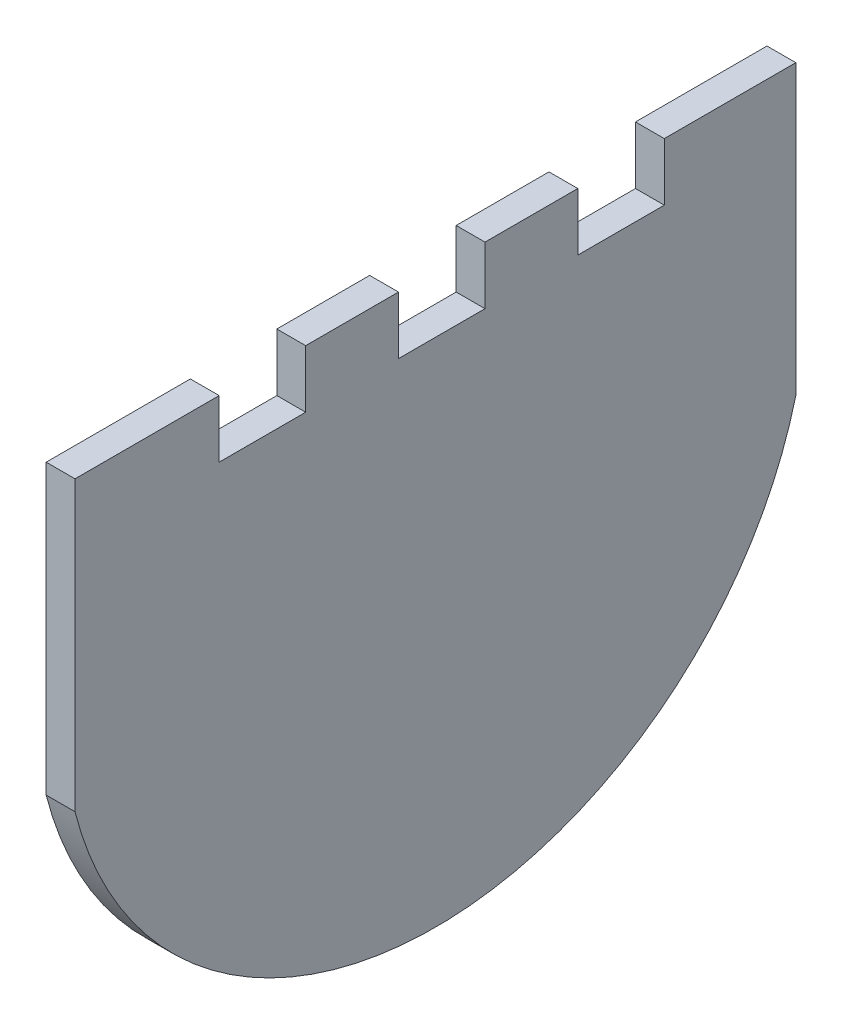
from build123d import *

# Parameters (mm, degrees)
BOSS_EXTRUDE2_DEPTH = 2.54
SKETCH3_W           = 2.54
SKETCH3_H           = 7.62
CUT_EXTRUDE2_DEPTH  = 5.08


with BuildPart() as part:
    # Sketch1 → Boss-Extrude2 (new body)
    with BuildSketch(Plane(origin=(0, 0, 0), x_dir=(0, 0, -1), z_dir=(1, 0, 0))):
        Polygon((-31.75, 33.376269743), (-31.75, 7.976269743), (31.75, 7.976269743), (31.75, 33.376269743), (0, 33.376269743), align=None)
        with BuildLine():
            ThreePointArc((31.75, 7.976269743), (0, -16.718131707), (-31.75, 7.976269743))
            Line((-31.75, 7.976269743), (31.75, 7.976269743))
        make_face()
    extrude(amount=BOSS_EXTRUDE2_DEPTH)

    # Sketch3 → Cut-Extrude2 (cut)
    with BuildSketch(Plane(origin=(0, 33.376269743, 0), x_dir=(1, 0, 0), z_dir=(0, 1, 0))):
        with Locations((1.27, -15.24)):
            Rectangle(SKETCH3_W, SKETCH3_H)
        with Locations((1.27, 0.557082085)):
            Rectangle(SKETCH3_W, SKETCH3_H)
        with Locations((1.27, 16.35416417)):
            Rectangle(SKETCH3_W, SKETCH3_H)
    extrude(amount=-CUT_EXTRUDE2_DEPTH, mode=Mode.SUBTRACT)


solid = part.part
